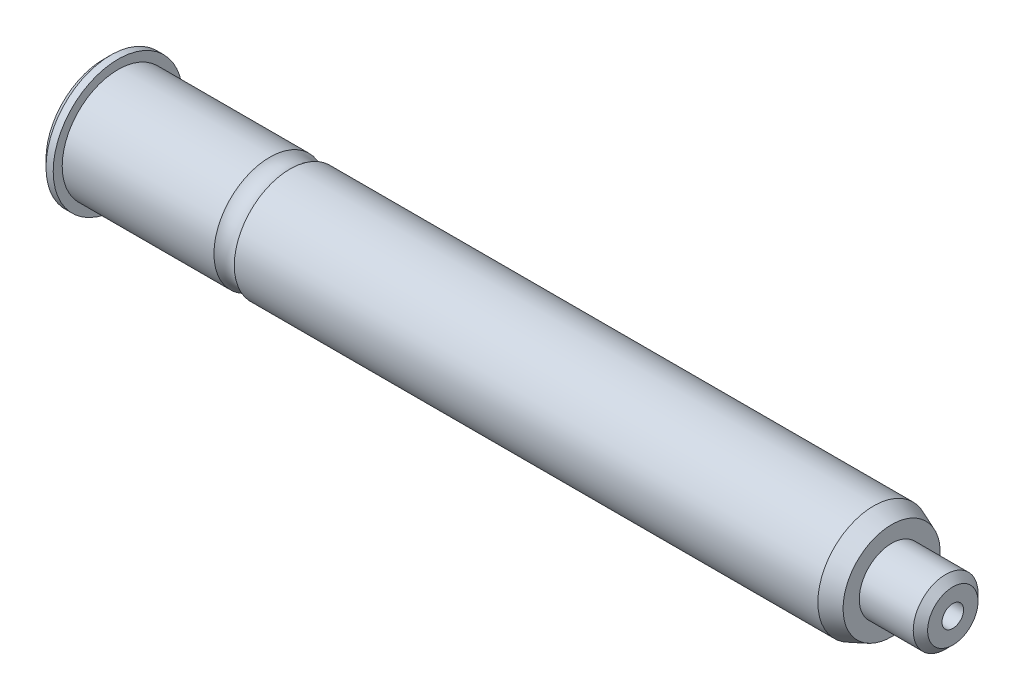
from build123d import *

# Parameters (mm, degrees)
CHANFREIN1_SIZE = 1
PER_AGE1_D      = 3
PER_AGE1_DEPTH  = 25
PER_AGE1_TIP    = 0.901290929


with BuildPart() as part:
    # Esquisse1 → Base-Révolution (revolve)
    with BuildSketch(Plane.XY, mode=Mode.PRIVATE) as base_r_volution_sk:
        with BuildLine():
            Line((0, 0), (0, -9))
            Line((0, -9), (2, -9))
            Line((2, -9), (2, -7.75))
            Line((2, -7.75), (23.085786438, -7.75))
            ThreePointArc((23.085786438, -7.75), (24.5, -7.25), (25.914213562, -7.75))
            Line((25.914213562, -7.75), (107, -7.75))
            Line((107, -7.75), (109.5, -6.75))
            Line((109.5, -6.75), (109.5, -4.5))
            Line((109.5, -4.5), (118, -4.5))
            Line((118, -4.5), (118, 0))
            Line((118, 0), (0, 0))
        make_face()
    revolve(base_r_volution_sk.sketch.rotate(Axis((-10, 0, 0), (1, 0, 0)), 270), axis=Axis((-10, 0, 0), (1, 0, 0)))

    # Chanfrein1
    chanfrein1_edges = [part.edges().sort_by_distance(p)[0] for p in [
        (0, 0, -9),
        (118, 0, -4.5),
    ]]
    chamfer(chanfrein1_edges, length=CHANFREIN1_SIZE)

    # Perçage1
    with Locations(Plane(origin=(118, 0, 0), x_dir=(0, 0, -1), z_dir=(1, 0, 0))):
        with Locations((0, 0)):
            Hole(PER_AGE1_D / 2, depth=PER_AGE1_DEPTH)
            with Locations((0, 0, -(PER_AGE1_DEPTH + PER_AGE1_TIP / 2))):  # 118° drill point
                Cone(0, PER_AGE1_D / 2, PER_AGE1_TIP, mode=Mode.SUBTRACT)


solid = part.part
